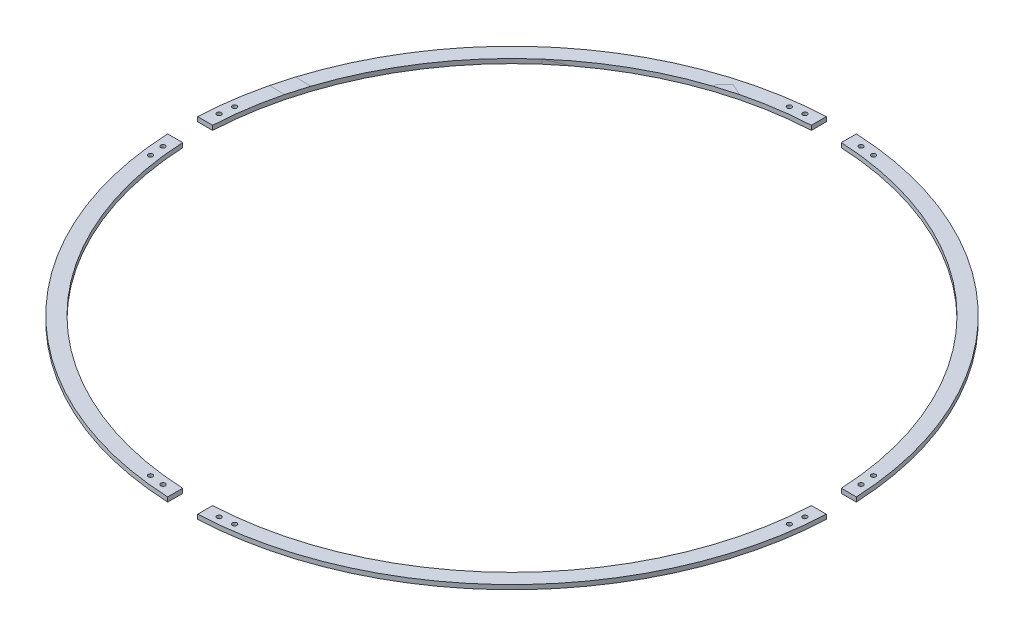
from build123d import *

# Parameters (mm, degrees)
BOSS_EXTRUDE2_DEPTH      = 1.5
F_3_0_3_DIAMETER_HOLE1_D = 3
SKETCH1_R                = 220
SKETCH1_R_2              = 210
BOSS_EXTRUDE1_DEPTH      = 1.5
QUADRUPLE_DEPTH          = 312.130599588
QUADRUPLE_DEPTH_BACK     = 312.130599588
SKETCH2_W                = 20
SKETCH2_H                = 440
SKETCH2_W_2              = 440
SKETCH2_H_2              = 20
CUT_EXTRUDE1_DEPTH       = 311.809024965
CUT_EXTRUDE1_DEPTH_BACK  = 311.809024965
SKETCH4_R                = 1.5


with BuildPart() as part:
    # Sketch5 → Boss-Extrude2 (new, symmetric)
    with BuildSketch(Plane(origin=(0, 0, 0), x_dir=(1, 0, 0), z_dir=(0, 1, 0))):
        with BuildLine():
            Line((-10, 219.772609758), (-10, 209.761769634))
            ThreePointArc((-10, 209.761769634), (-148.492424049, 148.492424049), (-209.761769634, 10))
            Line((-209.761769634, 10), (-219.772609758, 10))
            ThreePointArc((-219.772609758, 10), (-155.563491861, 155.563491861), (-10, 219.772609758))
        make_face()
    extrude(amount=BOSS_EXTRUDE2_DEPTH, both=True)

    # Ø3.0 (3) Diameter Hole1 (through all)
    with Locations(Plane(origin=(0, 1.5, 0), x_dir=(1, 0, 0), z_dir=(0, 1, 0))):
        with Locations((-214.18186009, 18.738484691), (-213.160645195, 28.063131327), (-28.063131327, 213.160645195), (-18.738484691, 214.18186009)):
            Hole(F_3_0_3_DIAMETER_HOLE1_D / 2)


with BuildPart() as body_2:
    # Sketch1 → Boss-Extrude1 (new, symmetric)
    with BuildSketch(Plane(origin=(0, 0, 0), x_dir=(1, 0, 0), z_dir=(0, 1, 0))):
        Circle(SKETCH1_R)
        Circle(SKETCH1_R_2, mode=Mode.SUBTRACT)
    extrude(amount=BOSS_EXTRUDE1_DEPTH, both=True)

    # Sketch2 → quadruple (cut, two sides: drawn at the far end of the back side and taken through both)
    with BuildSketch(Plane(origin=(0, 0, 0), x_dir=(1, 0, 0), z_dir=(0, 1, 0)).offset(-QUADRUPLE_DEPTH_BACK)):
        Rectangle(SKETCH2_W, SKETCH2_H)
        Rectangle(SKETCH2_W_2, SKETCH2_H_2)
    extrude(amount=QUADRUPLE_DEPTH + QUADRUPLE_DEPTH_BACK, mode=Mode.SUBTRACT)


with BuildPart() as quadruple_piece_1:
    # of the separate pieces the step leaves, piece 1, a body of its own (quadruple_pieces)
    add(body_2.part.solids().sort_by_distance((10, -1.5, 219.772609758))[0])


with BuildPart() as quadruple_piece_2:
    # of the separate pieces the step leaves, piece 2, a body of its own (quadruple_pieces)
    add(body_2.part.solids().sort_by_distance((219.772609758, -1.5, -10))[0])


with BuildPart() as quadruple_piece_3:
    # of the separate pieces the step leaves, piece 3, a body of its own (quadruple_pieces)
    add(body_2.part.solids().sort_by_distance((-10, 1.5, -209.761769634))[0])


with BuildPart() as quadruple_piece_4:
    # of the separate pieces the step leaves, piece 4, a body of its own (quadruple_pieces)
    add(body_2.part.solids().sort_by_distance((-219.772609758, 1.5, 10))[0])


with BuildPart() as cut_extrude1_tool:
    # Sketch4 → Cut-Extrude1 (new, two sides: drawn at the far end of the back side and taken through both)
    with BuildSketch(Plane(origin=(0, 0, 0), x_dir=(1, 0, 0), z_dir=(0, 1, 0)).offset(-CUT_EXTRUDE1_DEPTH_BACK)):
        with Locations((213.160645195, 28.063131327)):
            Circle(SKETCH4_R)
        with Locations((214.18186009, 18.738484691)):
            Circle(SKETCH4_R)
        with Locations((214.18186009, -18.738484691)):
            Circle(SKETCH4_R)
        with Locations((213.160645195, -28.063131327)):
            Circle(SKETCH4_R)
        with Locations((-28.063131327, 213.160645195)):
            Circle(SKETCH4_R)
        with Locations((-18.738484691, 214.18186009)):
            Circle(SKETCH4_R)
        with Locations((28.063131327, 213.160645195)):
            Circle(SKETCH4_R)
        with Locations((18.738484691, 214.18186009)):
            Circle(SKETCH4_R)
        with Locations((-213.160645195, 28.063131327)):
            Circle(SKETCH4_R)
        with Locations((-214.18186009, 18.738484691)):
            Circle(SKETCH4_R)
        with Locations((-214.18186009, -18.738484691)):
            Circle(SKETCH4_R)
        with Locations((-213.160645195, -28.063131327)):
            Circle(SKETCH4_R)
        with Locations((-28.063131327, -213.160645195)):
            Circle(SKETCH4_R)
        with Locations((-18.738484691, -214.18186009)):
            Circle(SKETCH4_R)
        with Locations((18.738484691, -214.18186009)):
            Circle(SKETCH4_R)
        with Locations((28.063131327, -213.160645195)):
            Circle(SKETCH4_R)
    extrude(amount=CUT_EXTRUDE1_DEPTH + CUT_EXTRUDE1_DEPTH_BACK)


with BuildPart() as quadruple_piece_1_1:
    add(quadruple_piece_1.part)

    # Cut-Extrude1: cut by cut_extrude1_tool
    add(cut_extrude1_tool.part, mode=Mode.SUBTRACT)


with BuildPart() as quadruple_piece_2_1:
    add(quadruple_piece_2.part)

    # Cut-Extrude1: cut by cut_extrude1_tool
    add(cut_extrude1_tool.part, mode=Mode.SUBTRACT)


with BuildPart() as quadruple_piece_3_1:
    add(quadruple_piece_3.part)

    # Cut-Extrude1: cut by cut_extrude1_tool
    add(cut_extrude1_tool.part, mode=Mode.SUBTRACT)


with BuildPart() as quadruple_piece_4_1:
    add(quadruple_piece_4.part)

    # Cut-Extrude1: cut by cut_extrude1_tool
    add(cut_extrude1_tool.part, mode=Mode.SUBTRACT)


solid = Compound([part.part, quadruple_piece_1_1.part, quadruple_piece_2_1.part, quadruple_piece_3_1.part, quadruple_piece_4_1.part])
